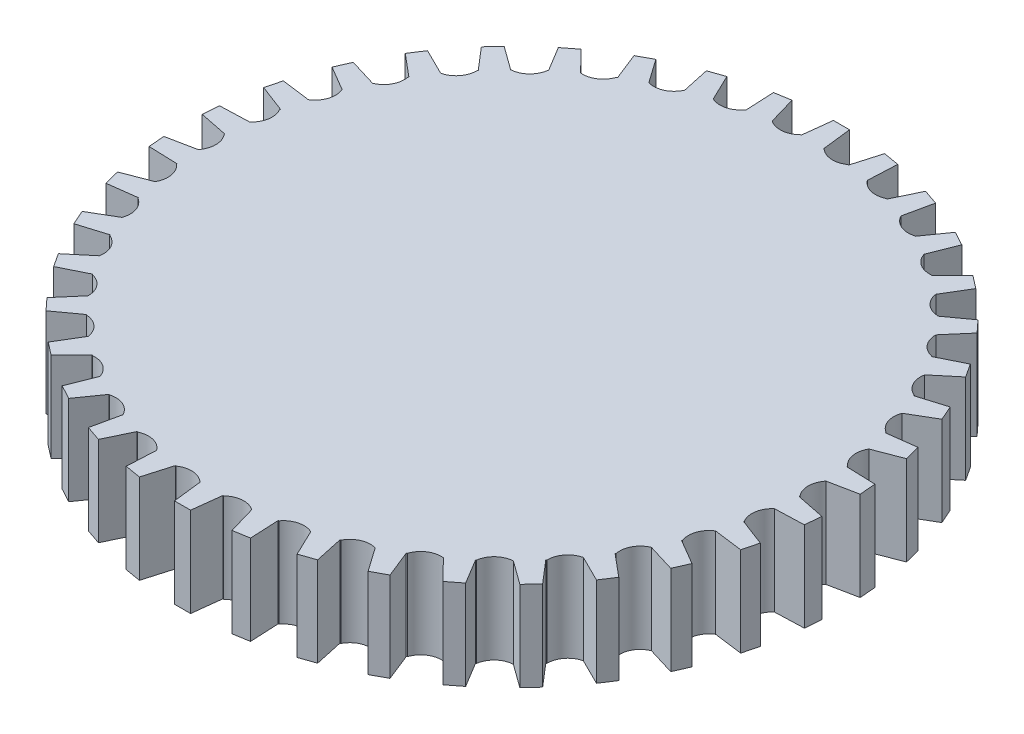
from build123d import *

# Parameters (mm, degrees)
SKETCH1_R           = 21.336
BOSS_EXTRUDE1_DEPTH = 6.35
BOSS_EXTRUDE2_START = -6.35
BOSS_EXTRUDE2_DEPTH = 6.35
CUT_EXTRUDE1_DEPTH  = 33.273996034
CIRPATTERN1_COUNT   = 38


with BuildPart() as part:
    # Sketch1 → Boss-Extrude1 (new body)
    with BuildSketch(Plane(origin=(0, 0, 0), x_dir=(1, 0, 0), z_dir=(0, 1, 0))):
        with Locations(Location((0, 0, 0), (0, 0, 270))):
            Circle(SKETCH1_R)
    extrude(amount=BOSS_EXTRUDE1_DEPTH)

    # Sketch2 → Boss-Extrude2 (add)
    with BuildSketch(Plane(origin=(0, 6.35, 0), x_dir=(1, 0, 0), z_dir=(0, 1, 0)).offset(BOSS_EXTRUDE2_START)):
        with BuildLine():
            Line((0.5715, 23.368), (-0.5715, 23.368))
            Line((-0.5715, 23.368), (-0.812927209, 21.320507624))
            ThreePointArc((-0.812927209, 21.320507624), (0, 21.336), (0.812927209, 21.320507624))
            Line((0.812927209, 21.320507624), (0.5715, 23.368))
        make_face()
    boss_extrude2 = extrude(amount=BOSS_EXTRUDE2_DEPTH)

    # Sketch2<4> → Cut-Extrude1 (cut, through all)
    with BuildSketch(Plane(origin=(0, 6.35, 0), x_dir=(1, 0, 0), z_dir=(0, 1, 0))):
        with BuildLine():
            ThreePointArc((0.812927209, 21.320507624), (1.735304589, 21.265314799), (2.654427209, 21.17023647))
            ThreePointArc((2.654427209, 21.17023647), (1.706708672, 20.914885726), (0.812927209, 21.320507624))
        make_face()
    cut_extrude1 = extrude(amount=-CUT_EXTRUDE1_DEPTH, mode=Mode.SUBTRACT)

    # CirPattern1: Boss-Extrude2, Cut-Extrude1 ×38 about axis
    cirpattern1_axis = Axis((0, 0, 0), (0, 1, 0))
    add([boss_extrude2.rotate(cirpattern1_axis, i * 360 / CIRPATTERN1_COUNT) for i in range(1, CIRPATTERN1_COUNT)])
    add([cut_extrude1.rotate(cirpattern1_axis, i * 360 / CIRPATTERN1_COUNT) for i in range(1, CIRPATTERN1_COUNT)], mode=Mode.SUBTRACT)


solid = part.part
